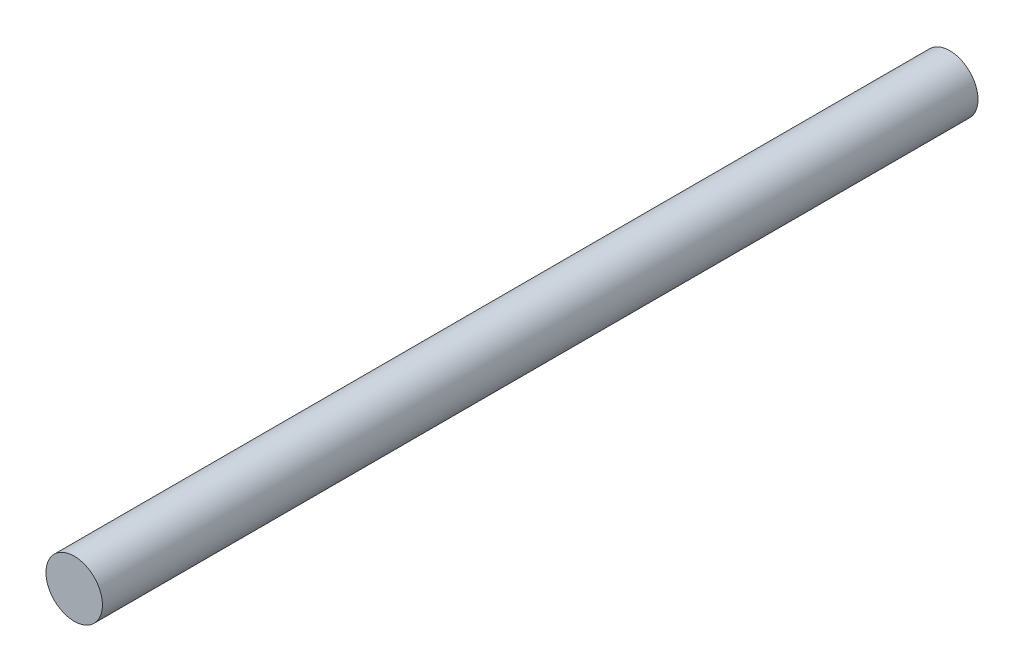
from build123d import *

# Parameters (mm, degrees)
SKETCH1_R           = 4
BOSS_EXTRUDE1_DEPTH = 124


with BuildPart() as part:
    # Sketch1 → Boss-Extrude1 (new body)
    with BuildSketch(Plane.XY):
        Circle(SKETCH1_R)
    extrude(amount=BOSS_EXTRUDE1_DEPTH)


solid = part.part
